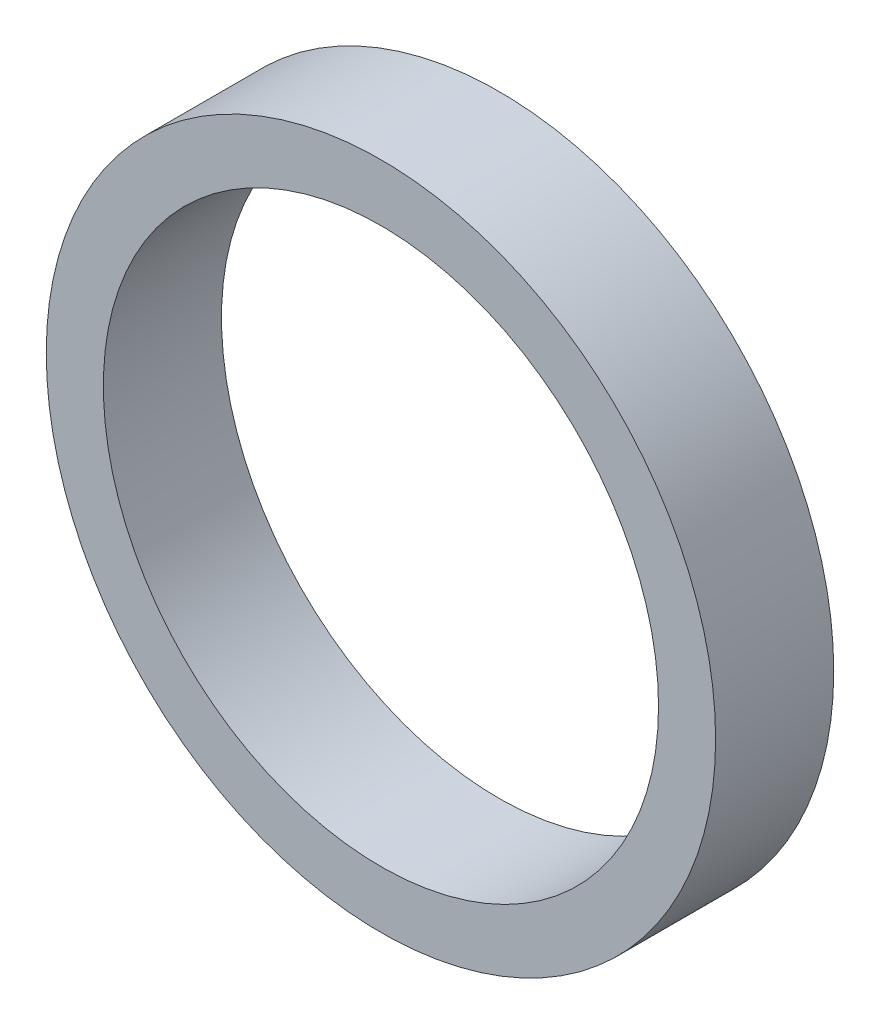
from build123d import *

# Parameters (mm, degrees)
SKETCH1_R           = 21.59
BOSS_EXTRUDE1_DEPTH = 7.62
SKETCH2_R           = 17.907
CUT_EXTRUDE1_DEPTH  = 7.62


with BuildPart() as part:
    # Sketch1 → Boss-Extrude1 (new body)
    with BuildSketch(Plane.XY):
        with Locations(Location((0, 0, 0), (0, 0, 180))):
            Circle(SKETCH1_R)
    extrude(amount=BOSS_EXTRUDE1_DEPTH)

    # Sketch2 → Cut-Extrude1 (cut)
    with BuildSketch(Plane.XY.offset(7.62)):
        Circle(SKETCH2_R)
    extrude(amount=-CUT_EXTRUDE1_DEPTH, mode=Mode.SUBTRACT)


solid = part.part
